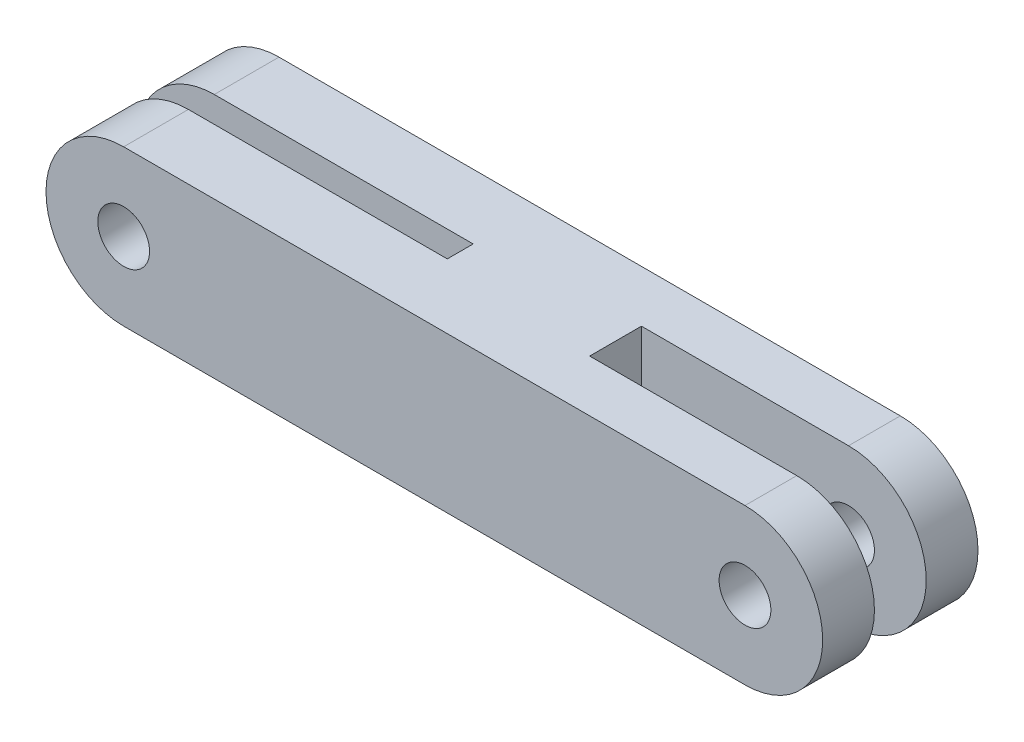
from build123d import *

# Parameters (mm, degrees)
SKETCH1_R               = 6.35
SKETCH1_R_2             = 7.220009846
BOSS_EXTRUDE1_DEPTH     = 38.1
SKETCH2_W               = 50.8
SKETCH2_H               = 25.4
CUT_EXTRUDE1_DEPTH      = 6.35
CUT_EXTRUDE2_DEPTH      = 131.862598214
CUT_EXTRUDE2_DEPTH_BACK = 131.862598214
SKETCH5_W               = 76.2
SKETCH5_H               = 12.7
SKETCH4_W               = 76.2
SKETCH4_H               = 6.35
CUT_EXTRUDE3_DEPTH      = 31.75
SKETCH6_R               = 7.62
SKETCH6_R_2             = 6.35
EXTRUDE_THIN1_DEPTH     = 12.7
SKETCH7_W               = 32.699691946
SKETCH7_H               = 6.35
CUT_EXTRUDE4_DEPTH      = 19.05


with BuildPart() as part:
    # Sketch1 → Boss-Extrude1 (new body)
    with BuildSketch(Plane.XY):
        with BuildLine():
            Line((-104.416317992, 20.723849372), (47.983682008, 20.723849372))
            ThreePointArc((47.983682008, 20.723849372), (67.033682008, 1.673849372), (47.983682008, -17.376150628))
            Line((47.983682008, -17.376150628), (-104.416317992, -17.376150628))
            ThreePointArc((-104.416317992, -17.376150628), (-123.466317992, 1.673849372), (-104.416317992, 20.723849372))
        make_face()
        with Locations(Location((47.983682008, 1.673849372, 0), (0, 0, 180))):
            Circle(SKETCH1_R, mode=Mode.SUBTRACT)
        with Locations(Location((-104.416317992, 1.673849372, 0), (0, 0, 180))):
            Circle(SKETCH1_R_2, mode=Mode.SUBTRACT)
    extrude(amount=BOSS_EXTRUDE1_DEPTH)

    # Sketch2 → Cut-Extrude1 (cut)
    with BuildSketch(Plane.XY):
        with Locations((-91.716317992, 1.673849372)):
            Rectangle(SKETCH2_W, SKETCH2_H)
    extrude(amount=CUT_EXTRUDE1_DEPTH, mode=Mode.SUBTRACT)

    # Sketch5 → Cut-Extrude2 (cut, two sides: drawn at the far end of the back side and taken through both)
    with BuildSketch(Plane(origin=(0, 0, 0), x_dir=(1, 0, 0), z_dir=(0, 1, 0)).offset(-CUT_EXTRUDE2_DEPTH_BACK)):
        with Locations((35.283682008, -19.05)):
            Rectangle(SKETCH5_W, SKETCH5_H)
    extrude(amount=CUT_EXTRUDE2_DEPTH + CUT_EXTRUDE2_DEPTH_BACK, mode=Mode.SUBTRACT)

    # Sketch4 → Cut-Extrude3 (cut)
    with BuildSketch(Plane(origin=(0, 20.723849372, 0), x_dir=(1, 0, 0), z_dir=(0, 1, 0))):
        with Locations((-79.016317992, -19.05)):
            Rectangle(SKETCH4_W, SKETCH4_H)
    extrude(amount=-CUT_EXTRUDE3_DEPTH, mode=Mode.SUBTRACT)

    # Sketch6 → Extrude-Thin1 (add)
    with BuildSketch(Plane(origin=(0, 0, 38.1), x_dir=(-1, 0, 0), z_dir=(0, 0, -1))):
        with Locations((104.416317992, 1.673849372)):
            Circle(SKETCH6_R)
        with Locations((104.416317992, 1.673849372)):
            Circle(SKETCH6_R_2, mode=Mode.SUBTRACT)
    extrude(amount=EXTRUDE_THIN1_DEPTH)

    # Sketch7 → Cut-Extrude4 (cut)
    with BuildSketch(Plane(origin=(0, 20.723849372, 0), x_dir=(1, 0, 0), z_dir=(0, 1, 0))):
        with Locations((-118.381657109, -19.05)):
            Rectangle(SKETCH7_W, SKETCH7_H)
    extrude(amount=-CUT_EXTRUDE4_DEPTH, mode=Mode.SUBTRACT)


solid = part.part
